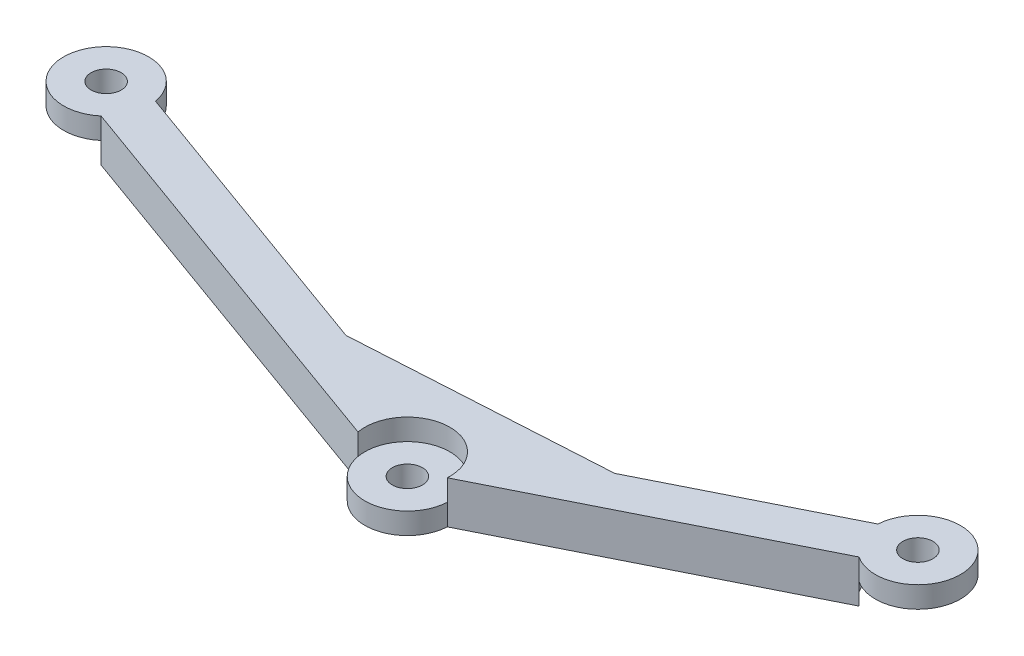
from build123d import *

# Parameters (mm, degrees)
SKETCH2_R           = 2.2479
BOSS_EXTRUDE2_DEPTH = 6.35
SKETCH3_R           = 6.35
CUT_EXTRUDE1_DEPTH  = 3.175
CUT_EXTRUDE2_START  = -3.175
SKETCH4_R           = 6.35
CUT_EXTRUDE2_DEPTH  = 3.175
BOSS_EXTRUDE4_DEPTH = 6.35


with BuildPart() as part:
    # Sketch2 → Boss-Extrude2 (new body)
    with BuildSketch(Plane(origin=(0, 0, 0), x_dir=(1, 0, 0), z_dir=(0, 1, 0))):
        with BuildLine():
            Line((76.696592015, -25.780461907), (117.659214316, -5.299150756))
            ThreePointArc((117.659214316, -5.299150756), (126.837612663, 2.839806331), (114.819407985, 0.380461907))
            Line((114.819407985, 0.380461907), (73.856785684, -20.100849244))
            ThreePointArc((73.856785684, -20.100849244), (69.986110983, -19.060899231), (66.263588885, -20.546310927))
            Line((66.263588885, -20.546310927), (6.250623597, 1.119019502))
            ThreePointArc((6.250623597, 1.119019502), (-5.972708576, 2.156212482), (4.094411115, -4.853689073))
            Line((4.094411115, -4.853689073), (64.107376403, -26.519019502))
            ThreePointArc((64.107376403, -26.519019502), (70.729889017, -31.739100769), (76.696592015, -25.780461907))
        make_face()
        with Locations(Location((70.358, -25.4, 0), (0, 0, 270))):
            Circle(SKETCH2_R, mode=Mode.SUBTRACT)
        with Locations(Location((0, 0, 0), (0, 0, 270))):
            Circle(SKETCH2_R, mode=Mode.SUBTRACT)
        with Locations(Location((121.158, 0, 0), (0, 0, 270))):
            Circle(SKETCH2_R, mode=Mode.SUBTRACT)
    extrude(amount=BOSS_EXTRUDE2_DEPTH)

    # Sketch3 → Cut-Extrude1 (cut)
    with BuildSketch(Plane.XZ):
        Circle(SKETCH3_R)
        with Locations((121.158, 0)):
            Circle(SKETCH3_R)
    extrude(amount=-CUT_EXTRUDE1_DEPTH, mode=Mode.SUBTRACT)

    # Sketch4 → Cut-Extrude2 (cut)
    with BuildSketch(Plane(origin=(0, 6.35, 0), x_dir=(1, 0, 0), z_dir=(0, 1, 0)).offset(CUT_EXTRUDE2_START)):
        with Locations((70.358, -25.4)):
            Circle(SKETCH4_R)
    extrude(amount=CUT_EXTRUDE2_DEPTH, mode=Mode.SUBTRACT)

    # Sketch7 → Boss-Extrude4 (add)
    with BuildSketch(Plane.XZ):
        with BuildLine():
            ThreePointArc((73.856785684, 20.100849244), (69.986110983, 19.060899231), (66.263588885, 20.546310927))
            Line((66.263588885, 20.546310927), (50.734546588, 14.940158473))
            Line((50.734546588, 14.940158473), (88.623778607, 12.717352782))
            Line((88.623778607, 12.717352782), (73.856785684, 20.100849244))
        make_face()
    extrude(amount=-BOSS_EXTRUDE4_DEPTH)


solid = part.part
